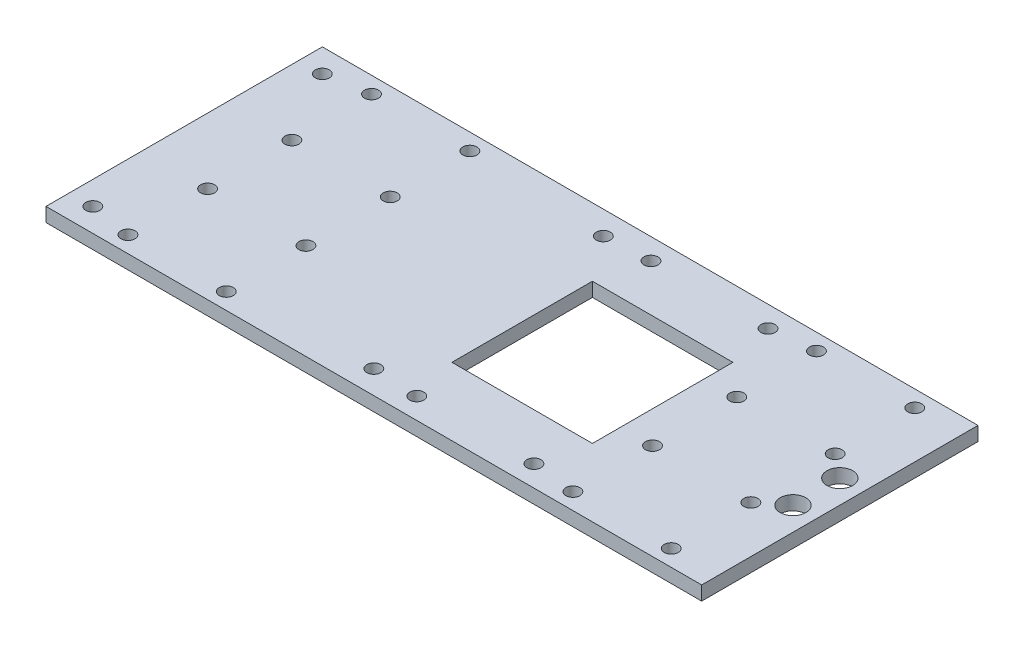
from build123d import *

# Parameters (mm, degrees)
SKETCH1_W           = 140
SKETCH1_H           = 59
SKETCH1_R           = 1.5
SKETCH1_W_2         = 30
SKETCH1_H_2         = 30
BOSS_EXTRUDE1_DEPTH = 3
SKETCH8_R           = 2.75
CUT_EXTRUDE6_DEPTH  = 77.021378572


with BuildPart() as part:
    # Sketch1 → Boss-Extrude1 (new body)
    with BuildSketch(Plane(origin=(0, 0, 0), x_dir=(1, 0, 0), z_dir=(0, 1, 0))):
        Rectangle(SKETCH1_W, SKETCH1_H)
        with Locations(Location((-35, 26, 0), (0, 0, 270))):
            Circle(SKETCH1_R, mode=Mode.SUBTRACT)
        with Locations(Location((-56, 26, 0), (0, 0, 270))):
            Circle(SKETCH1_R, mode=Mode.SUBTRACT)
        with Locations(Location((-56, 9, 0), (0, 0, 270))):
            Circle(SKETCH1_R, mode=Mode.SUBTRACT)
        with Locations(Location((-35, 9, 0), (0, 0, 270))):
            Circle(SKETCH1_R, mode=Mode.SUBTRACT)
        with Locations(Location((-35, -9, 0), (0, 0, 270))):
            Circle(SKETCH1_R, mode=Mode.SUBTRACT)
        with Locations(Location((-56, -9, 0), (0, 0, 270))):
            Circle(SKETCH1_R, mode=Mode.SUBTRACT)
        with Locations(Location((-35, -26, 0), (0, 0, 270))):
            Circle(SKETCH1_R, mode=Mode.SUBTRACT)
        with Locations(Location((-56, -26, 0), (0, 0, 270))):
            Circle(SKETCH1_R, mode=Mode.SUBTRACT)
        with Locations(Location((60, 26, 0), (0, 0, 270))):
            Circle(SKETCH1_R, mode=Mode.SUBTRACT)
        with Locations(Location((39, 26, 0), (0, 0, 270))):
            Circle(SKETCH1_R, mode=Mode.SUBTRACT)
        with Locations(Location((39, -9, 0), (0, 0, 270))):
            Circle(SKETCH1_R, mode=Mode.SUBTRACT)
        with Locations(Location((60, -9, 0), (0, 0, 270))):
            Circle(SKETCH1_R, mode=Mode.SUBTRACT)
        with Locations(Location((60, -26, 0), (0, 0, 270))):
            Circle(SKETCH1_R, mode=Mode.SUBTRACT)
        with Locations(Location((39, -26, 0), (0, 0, 270))):
            Circle(SKETCH1_R, mode=Mode.SUBTRACT)
        with Locations(Location((60, 9, 0), (0, 0, 270))):
            Circle(SKETCH1_R, mode=Mode.SUBTRACT)
        with Locations(Location((39, 9, 0), (0, 0, 270))):
            Circle(SKETCH1_R, mode=Mode.SUBTRACT)
        with Locations(Location((-5, -24.5, 0), (0, 0, 270))):
            Circle(SKETCH1_R, mode=Mode.SUBTRACT)
        with Locations(Location((-5, 24.5, 0), (0, 0, 270))):
            Circle(SKETCH1_R, mode=Mode.SUBTRACT)
        with Locations(Location((-65, 24.5, 0), (0, 0, 270))):
            Circle(SKETCH1_R, mode=Mode.SUBTRACT)
        with Locations(Location((-65, -24.5, 0), (0, 0, 270))):
            Circle(SKETCH1_R, mode=Mode.SUBTRACT)
        with Locations(Location((29.671375392, 25, 0), (0, 0, 270))):
            Circle(SKETCH1_R, mode=Mode.SUBTRACT)
        with Locations(Location((29.671375392, -25, 0), (0, 0, 270))):
            Circle(SKETCH1_R, mode=Mode.SUBTRACT)
        with Locations(Location((4.671375392, -25, 0), (0, 0, 270))):
            Circle(SKETCH1_R, mode=Mode.SUBTRACT)
        with Locations(Location((4.671375392, 25, 0), (0, 0, 270))):
            Circle(SKETCH1_R, mode=Mode.SUBTRACT)
        with Locations((17.171375392, 0)):
            Rectangle(SKETCH1_W_2, SKETCH1_H_2, mode=Mode.SUBTRACT)
    extrude(amount=BOSS_EXTRUDE1_DEPTH)

    # Sketch8 → Cut-Extrude6 (cut, through all)
    with BuildSketch(Plane(origin=(0, 3, 0), x_dir=(1, 0, 0), z_dir=(0, 1, 0))):
        with Locations(Location((65, 5, 0), (0, 0, 270))):
            Circle(SKETCH8_R)
        with Locations(Location((65, -5, 0), (0, 0, 270))):
            Circle(SKETCH8_R)
    extrude(amount=-CUT_EXTRUDE6_DEPTH, mode=Mode.SUBTRACT)


solid = part.part
